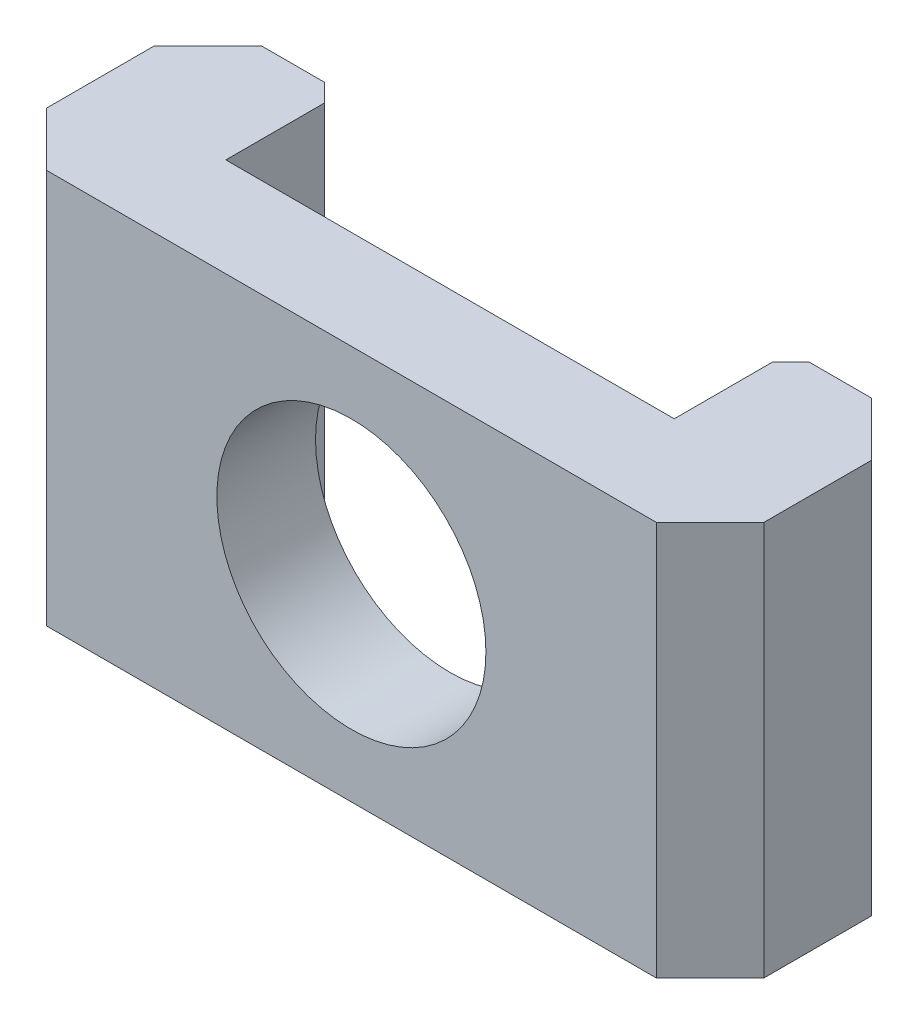
from build123d import *

# Parameters (mm, degrees)
SKETCH_1_W                 = 40
SKETCH_1_H                 = 22
EXTRUDE_1_DEPTH            = 6
M3_TAPPED_HOLE1_AT_2_COUNT = 2
M3_TAPPED_HOLE1_AT_2_PITCH = 33
CHAMFER_1_SIZE             = 0.5
SKETCH_5_R                 = 7.5
CUT_EXTRUDE_2_DEPTH        = 12
CHAMFER1_SIZE              = 0.5
SKETCH2_W                  = 25
SKETCH2_H                  = 22
EXTRUDE2_DEPTH             = 6.5
CHAMFER2_SIZE              = 1
CHAMFER3_SIZE              = 3


with BuildPart() as part:
    # 草图1 → 拉伸1 (new, symmetric)
    with BuildSketch(Plane.XY):
        Rectangle(SKETCH_1_W, SKETCH_1_H)
    extrude(amount=EXTRUDE_1_DEPTH, both=True)

    # 草图4 → M3 Tapped Hole1 (revolve, cut)
    with BuildSketch(Plane(origin=(-16.5, -11, 3.5), x_dir=(0, 0, -1), z_dir=(1, 0, 0))):
        Polygon((0, 0), (0, 10.251075774), (1.25, 9.5), (1.25, 0), align=None)
    m3_tapped_hole1 = revolve(axis=Axis((-16.5, -17.35, 3.5), (0, 1, 0)), mode=Mode.SUBTRACT)

    # M3 Tapped Hole1 at 2: M3 Tapped Hole1 ×2
    with Locations(*[(i * M3_TAPPED_HOLE1_AT_2_PITCH, 0, 0) for i in range(1, M3_TAPPED_HOLE1_AT_2_COUNT)]):
        add(m3_tapped_hole1, mode=Mode.SUBTRACT)

    # 倒角1
    chamfer_1_edges = [part.edges().sort_by_distance(p)[0] for p in [
        (16.5, -11, 4.75),
        (-16.5, -11, 4.75),
    ]]
    chamfer(chamfer_1_edges, length=CHAMFER_1_SIZE)

    # 草图5 → 拉伸2 (cut)
    with BuildSketch(Plane.XY.offset(6)):
        Circle(SKETCH_5_R)
    extrude(amount=-CUT_EXTRUDE_2_DEPTH, mode=Mode.SUBTRACT)

    # Mirror1: M3 Tapped Hole1 across plane
    add(m3_tapped_hole1.mirror(Plane.XY), mode=Mode.SUBTRACT)

    # Mirror1 copy 1 sketch → Mirror1 copy 1 (revolve, cut)
    with BuildSketch(Plane(origin=(16.5, -11, -3.5), x_dir=(0, 0, 1), z_dir=(1, 0, 0))):
        Polygon((0, 0), (0, -10.251075774), (1.25, -9.5), (1.25, 0), align=None)
    revolve(axis=Axis((16.5, -17.35, -3.5), (0, -1, 0)), mode=Mode.SUBTRACT)

    # Chamfer1
    chamfer1_edges = [part.edges().sort_by_distance(p)[0] for p in [
        (16.5, -11, -4.75),
        (-16.5, -11, -4.75),
    ]]
    chamfer(chamfer1_edges, length=CHAMFER1_SIZE)

    # Sketch2 → Extrude2 (cut)
    with BuildSketch(Plane(origin=(0, 0, -6), x_dir=(-1, 0, 0), z_dir=(0, 0, -1))):
        Rectangle(SKETCH2_W, SKETCH2_H)
    extrude(amount=-EXTRUDE2_DEPTH, mode=Mode.SUBTRACT)

    # Chamfer2
    chamfer2_edges = [part.edges().sort_by_distance(p)[0] for p in [
        (12.5, 0, -6),
        (-12.5, 0, -6),
    ]]
    chamfer(chamfer2_edges, length=CHAMFER2_SIZE)

    # Chamfer3
    chamfer3_edges = [part.edges().sort_by_distance(p)[0] for p in [
        (20, 0, 6),
        (-20, 0, 6),
        (20, 0, -6),
        (-20, 0, -6),
    ]]
    chamfer(chamfer3_edges, length=CHAMFER3_SIZE)


solid = part.part
